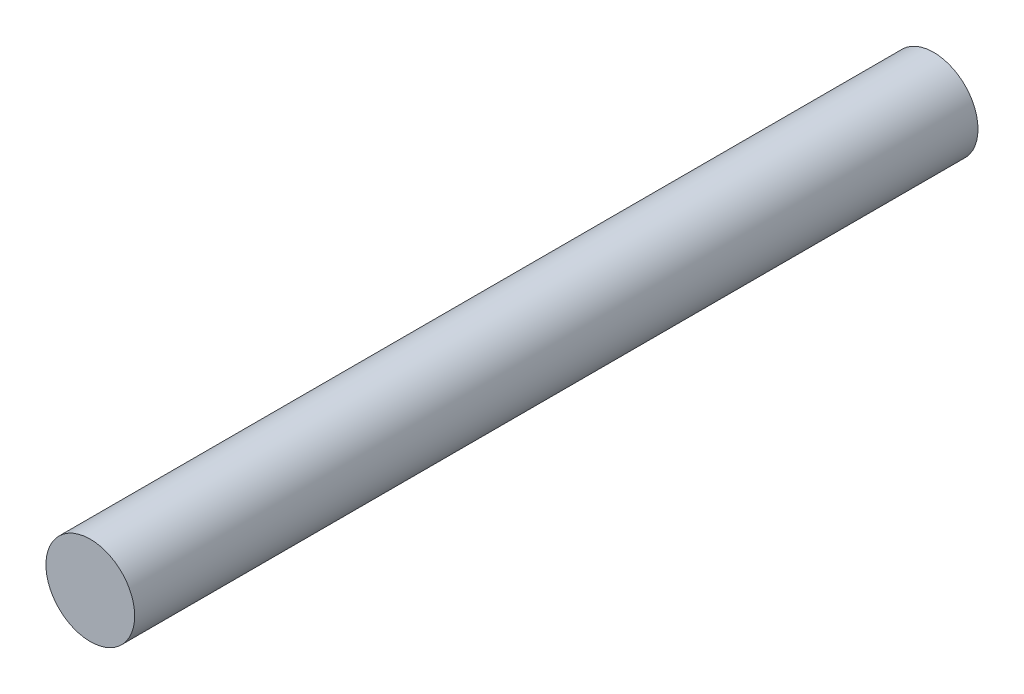
from build123d import *

# Parameters (mm, degrees)
SKETCH_1_R      = 2
EXTRUDE_1_DEPTH = 38


with BuildPart() as part:
    # ｽｹｯﾁ1 → ﾎﾞｽ - 押し出し1 (new body)
    with BuildSketch(Plane.XY):
        Circle(SKETCH_1_R)
    extrude(amount=EXTRUDE_1_DEPTH)


solid = part.part
